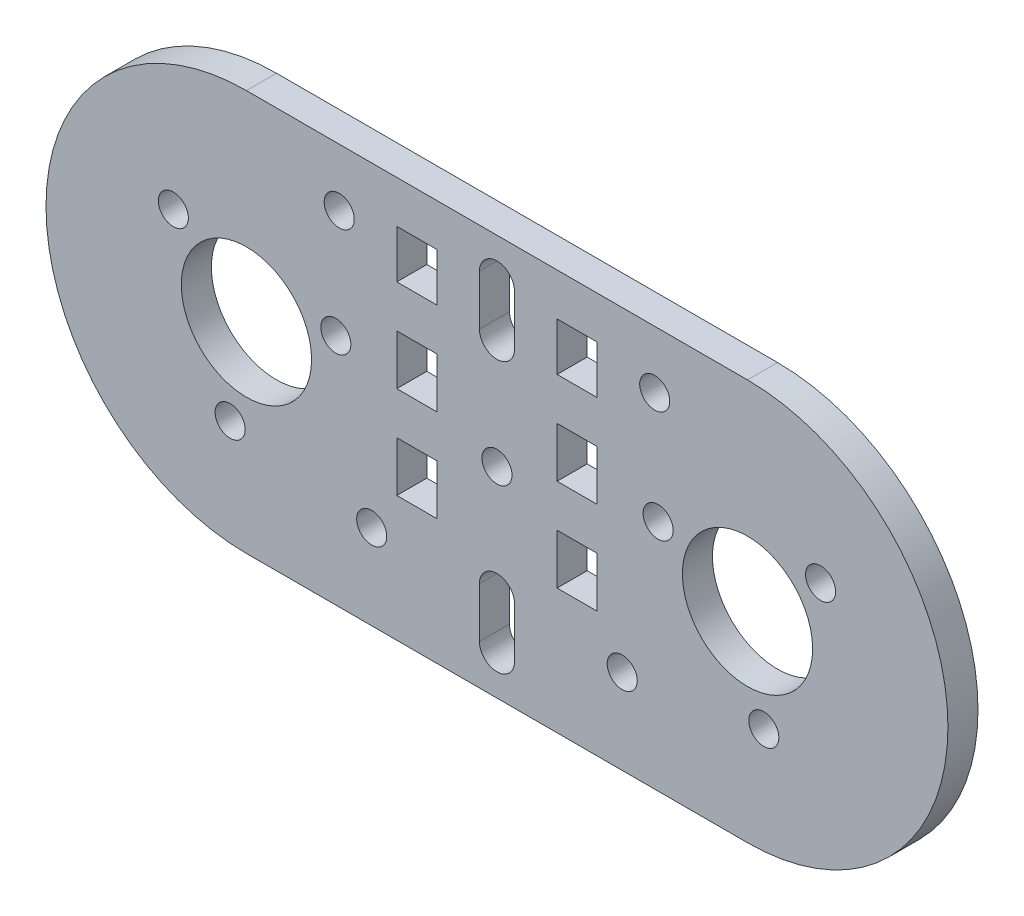
from build123d import *

# Parameters (mm, degrees)
SKETCH_1_R      = 1.5
SKETCH_1_R_2    = 6.5
SKETCH_1_W      = 4
SKETCH_1_H      = 4.8
SKETCH_1_H_2    = 5
EXTRUDE_1_DEPTH = 3


with BuildPart() as part:
    # 草图1 → 凸台-拉伸1 (new body)
    with BuildSketch(Plane.XY):
        with BuildLine():
            Line((38.62258193, 44.104762576), (19.62258193, 44.104762576))
            Line((19.62258193, 44.104762576), (17.62258193, 44.104762576))
            Line((17.62258193, 44.104762576), (9.62258193, 44.104762576))
            Line((9.62258193, 44.104762576), (7.62258193, 44.104762576))
            Line((7.62258193, 44.104762576), (-11.37741807, 44.104762576))
            ThreePointArc((-11.37741807, 44.104762576), (-31.37741807, 24.104762576), (-11.37741807, 4.104762576))
            Line((-11.37741807, 4.104762576), (38.62258193, 4.104762576))
            ThreePointArc((38.62258193, 4.104762576), (58.62258193, 24.104762576), (38.62258193, 44.104762576))
        make_face()
        with Locations((29.703887727, 27.376901588)):
            Circle(SKETCH_1_R, mode=Mode.SUBTRACT)
        with Locations((-2.458723867, 27.376901588)):
            Circle(SKETCH_1_R, mode=Mode.SUBTRACT)
        with Locations((-13.003009663, 14.744877322)):
            Circle(SKETCH_1_R, mode=Mode.SUBTRACT)
        with Locations((-18.670520681, 30.192508819)):
            Circle(SKETCH_1_R, mode=Mode.SUBTRACT)
        with Locations((45.91568454, 30.192508819)):
            Circle(SKETCH_1_R, mode=Mode.SUBTRACT)
        with Locations((-11.37741807, 24.104762576)):
            Circle(SKETCH_1_R_2, mode=Mode.SUBTRACT)
        with Locations((38.62258193, 24.104762576)):
            Circle(SKETCH_1_R_2, mode=Mode.SUBTRACT)
        with Locations((29.363598717, 38.36208455)):
            Circle(SKETCH_1_R, mode=Mode.SUBTRACT)
        with Locations((13.62258193, 24.104762576)):
            Circle(SKETCH_1_R, mode=Mode.SUBTRACT)
        with Locations((-2.118434858, 38.36208455)):
            Circle(SKETCH_1_R, mode=Mode.SUBTRACT)
        with Locations((40.248173522, 14.744877322)):
            Circle(SKETCH_1_R, mode=Mode.SUBTRACT)
        with Locations((26.12258193, 12.583043954)):
            Circle(SKETCH_1_R, mode=Mode.SUBTRACT)
        with Locations(Location((1.12258193, 12.583043954, 0), (0, 0, 180))):
            Circle(SKETCH_1_R, mode=Mode.SUBTRACT)
        with Locations((21.62258193, 37.474762576)):
            Rectangle(SKETCH_1_W, SKETCH_1_H, mode=Mode.SUBTRACT)
        with Locations((21.62258193, 28.344762576)):
            Rectangle(SKETCH_1_W, SKETCH_1_H_2, mode=Mode.SUBTRACT)
        with Locations((5.62258193, 37.474762576)):
            Rectangle(SKETCH_1_W, SKETCH_1_H, mode=Mode.SUBTRACT)
        with Locations((5.62258193, 28.344762576)):
            Rectangle(SKETCH_1_W, SKETCH_1_H_2, mode=Mode.SUBTRACT)
        with Locations((5.62258193, 19.114762576)):
            Rectangle(SKETCH_1_W, SKETCH_1_H_2, mode=Mode.SUBTRACT)
        with Locations((21.62258193, 19.114762576)):
            Rectangle(SKETCH_1_W, SKETCH_1_H_2, mode=Mode.SUBTRACT)
        with BuildLine():
            Line((11.87258193, 8.127075217), (11.87258193, 13.127075217))
            ThreePointArc((11.87258193, 13.127075217), (13.62258193, 14.877075217), (15.37258193, 13.127075217))
            Line((15.37258193, 13.127075217), (15.37258193, 8.127075217))
            ThreePointArc((15.37258193, 8.127075217), (13.62258193, 6.377075217), (11.87258193, 8.127075217))
        make_face(mode=Mode.SUBTRACT)
        with BuildLine():
            Line((15.37258193, 40.127075217), (15.37258193, 35.127075217))
            ThreePointArc((15.37258193, 35.127075217), (13.62258193, 33.377075217), (11.87258193, 35.127075217))
            Line((11.87258193, 35.127075217), (11.87258193, 40.127075217))
            ThreePointArc((11.87258193, 40.127075217), (13.62258193, 41.877075217), (15.37258193, 40.127075217))
        make_face(mode=Mode.SUBTRACT)
    extrude(amount=EXTRUDE_1_DEPTH)


solid = part.part
